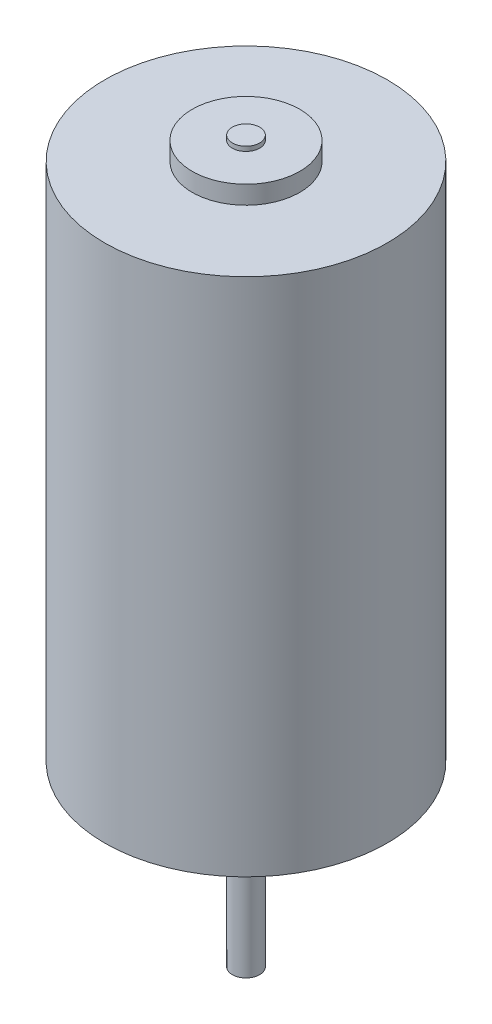
from build123d import *

# Parameters (mm, degrees)
TROU_TARAUD_M3X0_51_D     = 2.5
TROU_TARAUD_M3X0_51_DEPTH = 8.5
TROU_TARAUD_M3X0_51_TIP   = 0.751075774


with BuildPart() as part:
    # Esquisse1 → Révolution1 (revolve)
    with BuildSketch(Plane.XY, mode=Mode.PRIVATE) as r_volution1_sk:
        Polygon((0, -19.5), (0, 59.5), (1.5, 59.5), (1.5, 59), (5.9, 59), (5.9, 57), (15.5, 57), (15.5, 0), (5.9, 0), (5.9, -3), (1.5, -3), (1.5, -19.5), align=None)
    revolve(r_volution1_sk.sketch.rotate(Axis((0, 0, 0), (0, 1, 0)), 90), axis=Axis((0, 0, 0), (0, 1, 0)))

    # Trou taraudé M3x0.51
    with Locations(Plane(origin=(0, 0, 0), x_dir=(-1, 0, 0), z_dir=(0, -1, 0))):
        with Locations((0, -11), (-11, 0), (0, 11), (11, 0)):
            Hole(TROU_TARAUD_M3X0_51_D / 2, depth=TROU_TARAUD_M3X0_51_DEPTH)
            with Locations((0, 0, -(TROU_TARAUD_M3X0_51_DEPTH + TROU_TARAUD_M3X0_51_TIP / 2))):  # 118° drill point
                Cone(0, TROU_TARAUD_M3X0_51_D / 2, TROU_TARAUD_M3X0_51_TIP, mode=Mode.SUBTRACT)


solid = part.part
